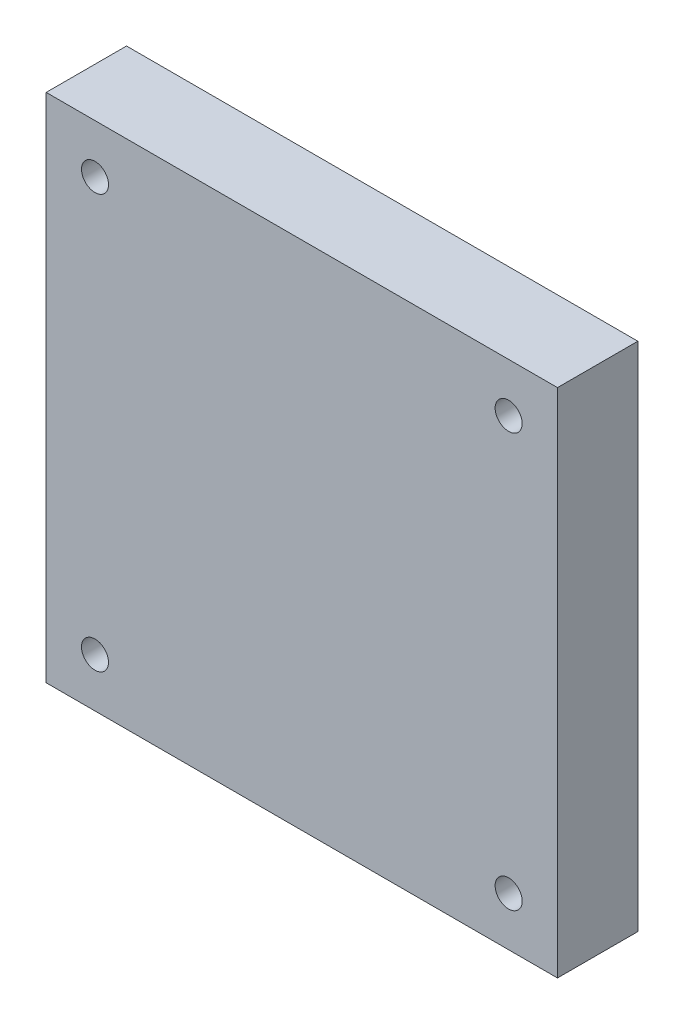
from build123d import *

# Parameters (mm, degrees)
SKETCH1_W           = 50
SKETCH1_H           = 50
BOSS_EXTRUDE1_DEPTH = 1.4
EXTRUDE_D_DEPTH     = 10
SKETCH32_W          = 50
SKETCH32_H          = 5
F_4_FLAT_DEPTH      = 57.789083608
SKETCH9_W           = 70
SKETCH9_H           = 70
SKETCH9_R           = 1.85
BOSS_EXTRUDE5_DEPTH = 10
SKETCH11_W          = 70
SKETCH11_H          = 70
SKETCH11_R          = 1.85
SKETCH11_W_2        = 50
SKETCH11_H_2        = 50
BOSS_EXTRUDE7_DEPTH = 1
SKETCH33_W          = 2.596153847
SKETCH33_H          = 1.25
SKETCH33_W_2        = 1.346153846
SKETCH33_H_2        = 7.692307692
TEXT_4_DEPTH        = 1


with BuildPart() as part:
    # Sketch1 → Boss-Extrude1 (new body)
    with BuildSketch(Plane.XY):
        Rectangle(SKETCH1_W, SKETCH1_H)
    extrude(amount=BOSS_EXTRUDE1_DEPTH)

    # Sketch12 → Extrude d (add)
    with BuildSketch(Plane.XY):
        with BuildLine():
            Line((-15.384615385, -20), (-15.384615385, 20))
            Line((-15.384615385, 20), (-1.706730769, 20))
            add(Edge.make_bspline(
                [(-1.706730769, 20), (-1.332795644, 19.998310706), (-0.606211068, 19.995028279), (0.449226871, 19.974107957), (1.437502743, 19.923648357), (2.354062691, 19.86218189), (3.203529353, 19.780344569), (3.984817479, 19.688830068), (4.698536687, 19.569461366), (5.147259767, 19.470243713), (5.360576923, 19.423076923)],
                knots=[0, 0, 0, 0, 1.263127796, 2.454354013, 3.565393221, 4.605443485, 5.557051711, 6.447822442, 7.26211484, 8, 8, 8, 8], degree=3))
            add(Edge.make_bspline(
                [(5.360576923, 19.423076923), (5.912251843, 19.27833856), (6.996071125, 18.993985904), (8.525996045, 18.354371359), (9.9305337, 17.552091621), (10.76351295, 16.891243678), (11.177884615, 16.5625)],
                knots=[0, 0, 0, 0, 1.04477941, 2.052571232, 3.03123721, 4, 4, 4, 4], degree=3))
            add(Edge.make_bspline(
                [(11.177884615, 16.5625), (11.435165615, 16.33656553), (11.950892228, 15.883673869), (12.659239662, 15.137501768), (13.316361869, 14.345934435), (13.941886088, 13.52259936), (14.495804357, 12.637479906), (15.015025008, 11.716052181), (15.467911147, 10.739812679), (15.884786016, 9.724715962), (16.256193081, 8.666805497), (16.561365357, 7.566764468), (16.841721552, 6.436079941), (17.050241451, 5.26239225), (17.232268536, 4.055656741), (17.347824248, 2.808966533), (17.422800679, 1.526043216), (17.431489341, 0.657162879), (17.435897436, 0.216346154)],
                knots=[0, 0, 0, 0, 0.908997367, 1.822109427, 2.728529095, 3.640759027, 4.565643067, 5.499218265, 6.448003669, 7.421473682, 8.413047621, 9.423472075, 10.452328391, 11.505545429, 12.587978234, 13.692612971, 14.829372988, 16, 16, 16, 16], degree=3))
            add(Edge.make_bspline(
                [(17.435897436, 0.216346154), (17.425152546, -0.521351998), (17.404243244, -1.956895234), (17.197458208, -4.044866145), (16.877475921, -6.007490436), (16.411786994, -7.832983164), (15.838242455, -9.511219494), (15.212555157, -11.055905966), (14.49234461, -12.440426237), (13.702289791, -13.676483907), (12.855766993, -14.771899689), (11.96893387, -15.743113895), (11.039161564, -16.590556291), (10.071173098, -17.336467152), (9.014695501, -17.954101856), (7.880812129, -18.508685792), (6.632736172, -18.954293775), (5.293971254, -19.344076914), (3.848792963, -19.636093055), (2.30502701, -19.850675912), (0.656606295, -19.980436853), (-0.475187738, -19.993352604), (-1.057692308, -20)],
                knots=[0, 0, 0, 0, 1.410753827, 2.745293735, 4.009435601, 5.211453015, 6.344066657, 7.400119332, 8.396481539, 9.324811333, 10.202671465, 11.041621015, 11.837259285, 12.606727868, 13.374311266, 14.17412185, 15.017911533, 15.905707008, 16.839601966, 17.835295848, 18.885883805, 20, 20, 20, 20], degree=3))
            Line((-1.057692308, -20), (-15.384615385, -20))
        make_face()
        with BuildLine():
            Line((-9.743589744, -15.384615385), (-1.498397436, -15.384615385))
            add(Edge.make_bspline(
                [(-1.498397436, -15.384615385), (-0.897178524, -15.375615381), (0.240193705, -15.35858938), (1.844846318, -15.227830177), (3.24533825, -15.0022881), (4.45719944, -14.681402607), (5.508678182, -14.266448389), (6.434510357, -13.775873386), (7.258049637, -13.219181022), (7.72194942, -12.773803849), (7.948717949, -12.556089744)],
                knots=[0, 0, 0, 0, 1.423649224, 2.693227144, 3.808972214, 4.778671344, 5.656058397, 6.479437267, 7.256702014, 8, 8, 8, 8], degree=3))
            add(Edge.make_bspline(
                [(7.948717949, -12.556089744), (8.243811943, -12.218672046), (8.850036503, -11.525500043), (9.604943306, -10.314565428), (10.263258794, -8.95203212), (10.813573136, -7.423395117), (11.264816654, -5.733824846), (11.565778867, -3.868187599), (11.762550487, -1.83916885), (11.783829732, -0.427858936), (11.794871795, 0.304487179)],
                knots=[0, 0, 0, 0, 0.782184731, 1.606876467, 2.483531085, 3.422528604, 4.441347086, 5.534669947, 6.720709839, 8, 8, 8, 8], degree=3))
            add(Edge.make_bspline(
                [(11.794871795, 0.304487179), (11.788030201, 0.814721083), (11.774730419, 1.806595127), (11.69181767, 3.25158927), (11.528135708, 4.603959234), (11.318801793, 5.866044088), (11.032989165, 7.033832073), (10.706157482, 8.118511893), (10.294992017, 9.10590411), (9.82580183, 10.003631417), (9.311094744, 10.81765568), (8.774751475, 11.565461585), (8.214027295, 12.244597356), (7.617040894, 12.845400099), (7.001738383, 13.385636887), (6.356648869, 13.854247255), (5.683577539, 14.251087218), (5.21061462, 14.457089897), (4.975961538, 14.559294872)],
                knots=[0, 0, 0, 0, 1.460126857, 2.838427476, 4.139102445, 5.35666337, 6.496721546, 7.577303074, 8.594995104, 9.55219858, 10.472533725, 11.348579167, 12.184287935, 12.989560785, 13.769667798, 14.524891986, 15.268148459, 16, 16, 16, 16], degree=3))
            add(Edge.make_bspline(
                [(4.975961538, 14.559294872), (4.792612941, 14.626392529), (4.404109286, 14.768568064), (3.770033649, 14.929489388), (3.062398823, 15.077581581), (2.274229901, 15.18152299), (1.409513027, 15.282542702), (0.462873148, 15.343930282), (-0.560725019, 15.37174952), (-1.268682281, 15.380231282), (-1.634615385, 15.384615385)],
                knots=[0, 0, 0, 0, 0.699400087, 1.48198292, 2.341906832, 3.289648813, 4.329964754, 5.462247508, 6.688271602, 8, 8, 8, 8], degree=3))
            Line((-1.634615385, 15.384615385), (-9.743589744, 15.384615385))
            Line((-9.743589744, 15.384615385), (-9.743589744, -15.384615385))
        make_face(mode=Mode.SUBTRACT)
    extrude(amount=EXTRUDE_D_DEPTH)

    # Sketch32 → 4-flat (cut, through all)
    with BuildSketch(Plane.XZ.offset(25)):
        with Locations((0, 12.49)):
            Rectangle(SKETCH32_W, SKETCH32_H)
    extrude(amount=-F_4_FLAT_DEPTH, mode=Mode.SUBTRACT)


with BuildPart() as body_2:
    # Sketch9 → Boss-Extrude5 (new body)
    with BuildSketch(Plane.XY.offset(1.4)):
        Rectangle(SKETCH9_W, SKETCH9_H)
        with Locations((28.313708499, -28.313708499)):
            Circle(SKETCH9_R, mode=Mode.SUBTRACT)
        with Locations((-28.313708499, -28.313708499)):
            Circle(SKETCH9_R, mode=Mode.SUBTRACT)
        with Locations((-28.313708499, 28.313708499)):
            Circle(SKETCH9_R, mode=Mode.SUBTRACT)
        with Locations((28.313708499, 28.313708499)):
            Circle(SKETCH9_R, mode=Mode.SUBTRACT)
    extrude(amount=BOSS_EXTRUDE5_DEPTH)

    # Combine1: cut part
    add(part.part, mode=Mode.SUBTRACT)

    # Sketch11 → Boss-Extrude7 (add)
    with BuildSketch(Plane(origin=(0, 0, 1.4), x_dir=(-1, 0, 0), z_dir=(0, 0, -1))):
        Rectangle(SKETCH11_W, SKETCH11_H)
        with Locations((-28.313708499, -28.313708499)):
            Circle(SKETCH11_R, mode=Mode.SUBTRACT)
        with Locations((28.313708499, -28.313708499)):
            Circle(SKETCH11_R, mode=Mode.SUBTRACT)
        with Locations((28.313708499, 28.313708499)):
            Circle(SKETCH11_R, mode=Mode.SUBTRACT)
        with Locations((-28.313708499, 28.313708499)):
            Circle(SKETCH11_R, mode=Mode.SUBTRACT)
        Rectangle(SKETCH11_W_2, SKETCH11_H_2, mode=Mode.SUBTRACT)
    extrude(amount=BOSS_EXTRUDE7_DEPTH)

    # Sketch33 → text-4 (cut)
    # profile 1 of 6: a face of its own
    with BuildSketch(Plane.XZ.offset(35)):
        Polygon((9.287860577, 2.207692308), (7.884615385, 2.207692308), (7.884615385, 7.111538462), (7.211538462, 7.111538462), (7.211538462, 8.361538462), (7.884615385, 8.361538462), (7.884615385, 9.9), (9.230769231, 9.9), (9.230769231, 8.361538462), (12.403846154, 8.361538462), (12.403846154, 6.998858173), align=None)
        Polygon((9.230769231, 7.111538462), (9.230769231, 4.558954327), (10.890925481, 7.111538462), align=None, mode=Mode.SUBTRACT)
    # profile 2 of 6: a face of its own
    with BuildSketch(Plane.XZ.offset(35)):
        with Locations((4.663461539, 7.159615385)):
            Rectangle(SKETCH33_W, SKETCH33_H)
    # profile 3 of 6: a face of its own
    with BuildSketch(Plane.XZ.offset(35)):
        with BuildLine():
            Line((2.5, 4.419230769), (2.019230769, 4.419230769))
            add(Edge.make_bspline(
                [(2.019230769, 4.419230769), (2.018909483, 4.332089615), (2.018301974, 4.167317541), (2.014714131, 3.933954446), (2.012294671, 3.728605768), (2.007972983, 3.551303093), (2.001890667, 3.402565771), (1.995655651, 3.282401933), (1.990985205, 3.190053414), (1.984400497, 3.138160069), (1.981670673, 3.116646635)],
                knots=[0, 0, 0, 0, 1.604323161, 3.033556972, 4.296844687, 5.385167547, 6.298701784, 7.037230881, 7.60086462, 8, 8, 8, 8], degree=3))
            add(Edge.make_bspline(
                [(1.981670673, 3.116646635), (1.968870201, 3.042836755), (1.943917749, 2.898956322), (1.861317076, 2.698416134), (1.741291639, 2.523722672), (1.614057307, 2.400414792), (1.4961437, 2.316235622), (1.397223982, 2.261255195), (1.289666814, 2.214120164), (1.173124682, 2.177160649), (1.048705977, 2.146969452), (0.915068007, 2.125982028), (0.772943954, 2.114416117), (0.675100668, 2.112512969), (0.625, 2.111538462)],
                knots=[0, 0, 0, 0, 1.43722947, 2.801646624, 4.13175475, 5.486897933, 6.18427957, 6.91287343, 7.658885333, 8.438447905, 9.260561323, 10.118602268, 11.036630026, 12, 12, 12, 12], degree=3))
            add(Edge.make_bspline(
                [(0.625, 2.111538462), (0.548231473, 2.113897415), (0.388833384, 2.118795419), (0.143291222, 2.159647185), (-0.117464635, 2.220719018), (-0.293362492, 2.278419376), (-0.384615385, 2.308353365)],
                knots=[0, 0, 0, 0, 0.891295899, 1.85063944, 2.884947376, 4, 4, 4, 4], degree=3))
            Line((-0.384615385, 2.308353365), (-0.384615385, 3.355528846))
            add(Edge.make_bspline(
                [(-0.384615385, 3.355528846), (-0.335665061, 3.341994907), (-0.242305855, 3.31618266), (-0.107976747, 3.287528773), (0.013057853, 3.269835069), (0.089094519, 3.266803963), (0.124699519, 3.265384615)],
                knots=[0, 0, 0, 0, 1.174725213, 2.24046353, 3.176077791, 4, 4, 4, 4], degree=3))
            add(Edge.make_bspline(
                [(0.124699519, 3.265384615), (0.163947673, 3.265953584), (0.23759192, 3.267021182), (0.338529747, 3.289855768), (0.426558231, 3.318059591), (0.471500659, 3.353680425), (0.492788462, 3.370552885)],
                knots=[0, 0, 0, 0, 1.200739268, 2.253036902, 3.172518975, 4, 4, 4, 4], degree=3))
            add(Edge.make_bspline(
                [(0.492788462, 3.370552885), (0.506447776, 3.386933738), (0.53628391, 3.42271455), (0.559054252, 3.498508954), (0.576037267, 3.591558731), (0.576609836, 3.661380955), (0.576923077, 3.699579327)],
                knots=[0, 0, 0, 0, 0.730107156, 1.594778094, 2.684150175, 4, 4, 4, 4], degree=3))
            Line((0.576923077, 3.699579327), (0.581430288, 4.419230769))
            Line((0.581430288, 4.419230769), (-0.288461538, 4.419230769))
            Line((-0.288461538, 4.419230769), (-0.288461538, 5.573076923))
            Line((-0.288461538, 5.573076923), (0.673076923, 5.573076923))
            Line((0.673076923, 5.573076923), (0.673076923, 9.9))
            Line((0.673076923, 9.9), (2.019230769, 9.9))
            Line((2.019230769, 9.9), (2.019230769, 5.573076923))
            Line((2.019230769, 5.573076923), (2.5, 5.573076923))
            Line((2.5, 5.573076923), (2.5, 4.419230769))
        make_face()
    # profile 4 of 6: a face of its own
    with BuildSketch(Plane.XZ.offset(35)):
        with Locations((-1.634615385, 6.053846154)):
            Rectangle(SKETCH33_W_2, SKETCH33_H_2)
    # profile 5 of 6: a face of its own
    with BuildSketch(Plane.XZ.offset(35)):
        with BuildLine():
            Line((-7.692307692, 4.419230769), (-9.038461538, 4.419230769))
            Line((-9.038461538, 4.419230769), (-9.038461538, 9.9))
            Line((-9.038461538, 9.9), (-7.692307692, 9.9))
            Line((-7.692307692, 9.9), (-7.692307692, 9.302043269))
            add(Edge.make_bspline(
                [(-7.692307692, 9.302043269), (-7.625488732, 9.360074686), (-7.495584917, 9.472894498), (-7.293158093, 9.621829792), (-7.087372706, 9.739854752), (-6.882311822, 9.837817852), (-6.670900063, 9.907700981), (-6.453408879, 9.959638178), (-6.226811606, 9.989902765), (-6.072804406, 9.994048448), (-5.994591346, 9.996153846)],
                knots=[0, 0, 0, 0, 1.129087683, 2.195077524, 3.200104641, 4.152071996, 5.089690739, 6.035159067, 7.002149119, 8, 8, 8, 8], degree=3))
            add(Edge.make_bspline(
                [(-5.994591346, 9.996153846), (-5.90679034, 9.994179284), (-5.733290575, 9.990277436), (-5.478706621, 9.949180385), (-5.232850586, 9.886323296), (-4.996064619, 9.797186258), (-4.76800184, 9.682247486), (-4.549838284, 9.541835957), (-4.340588128, 9.37624396), (-4.1434782, 9.187149991), (-3.961081537, 8.980239978), (-3.800763279, 8.758813642), (-3.666036304, 8.524042041), (-3.556566087, 8.277105213), (-3.470097383, 8.018105201), (-3.408512551, 7.746450941), (-3.372164154, 7.462091039), (-3.367666351, 7.268394467), (-3.365384615, 7.170132212)],
                knots=[0, 0, 0, 0, 0.980635182, 1.937790695, 2.874612845, 3.813473129, 4.759763495, 5.72404569, 6.708444218, 7.737858197, 8.773145527, 9.787642451, 10.788159158, 11.793035368, 12.802034882, 13.835443946, 14.901920881, 16, 16, 16, 16], degree=3))
            add(Edge.make_bspline(
                [(-3.365384615, 7.170132212), (-3.36777689, 7.068380381), (-3.372469603, 6.868782827), (-3.406874129, 6.575904846), (-3.467198205, 6.297456922), (-3.550281027, 6.032998797), (-3.65468778, 5.781748892), (-3.787184468, 5.546716112), (-3.940902639, 5.324297486), (-4.116959442, 5.118725468), (-4.310137727, 4.933729001), (-4.513908031, 4.769500578), (-4.728599626, 4.630793334), (-4.9547511, 4.518894103), (-5.189981771, 4.431570533), (-5.435444055, 4.3678198), (-5.691392879, 4.329505755), (-5.865754879, 4.325237664), (-5.954026442, 4.323076923)],
                knots=[0, 0, 0, 0, 1.136340375, 2.229058262, 3.287747549, 4.313796199, 5.321476843, 6.32056726, 7.321347234, 8.336944959, 9.337787455, 10.30479778, 11.255888616, 12.186428358, 13.117354666, 14.053442213, 15.014546185, 16, 16, 16, 16], degree=3))
            add(Edge.make_bspline(
                [(-5.954026442, 4.323076923), (-6.035803562, 4.32473283), (-6.197611006, 4.328009274), (-6.435160916, 4.365108239), (-6.666205686, 4.417962402), (-6.888610421, 4.49674232), (-7.103450804, 4.598102368), (-7.309193238, 4.722107803), (-7.508593458, 4.866597305), (-7.630313005, 4.979310973), (-7.692307692, 5.03671875)],
                knots=[0, 0, 0, 0, 1.016860689, 2.012000776, 2.985574089, 3.963288254, 4.94189597, 5.937036056, 6.949282938, 8, 8, 8, 8], degree=3))
            Line((-7.692307692, 5.03671875), (-7.692307692, 4.419230769))
        make_face()
        with BuildLine():
            add(Edge.make_bspline(
                [(-6.236478365, 5.573076923), (-6.182838533, 5.574723508), (-6.077707963, 5.577950708), (-5.92309175, 5.597343943), (-5.775353156, 5.631570761), (-5.635414297, 5.681943511), (-5.501907063, 5.743856985), (-5.374803235, 5.818877303), (-5.255927423, 5.910316657), (-5.14409319, 6.013146698), (-5.041449097, 6.126315588), (-4.955140989, 6.250787544), (-4.878509852, 6.380579261), (-4.816696585, 6.519086614), (-4.770936604, 6.666143169), (-4.735229566, 6.820115776), (-4.716611391, 6.982379423), (-4.713246357, 7.09296946), (-4.711538462, 7.149098558)],
                knots=[0, 0, 0, 0, 1.048146026, 2.054297773, 3.039291333, 4.004895774, 4.954855183, 5.911393651, 6.882091317, 7.879305688, 8.877191939, 9.859995919, 10.833402353, 11.818978979, 12.815424932, 13.838562528, 14.902979527, 16, 16, 16, 16], degree=3))
            add(Edge.make_bspline(
                [(-4.711538462, 7.149098558), (-4.713220993, 7.205736551), (-4.716536401, 7.317341061), (-4.735521569, 7.480976691), (-4.769978421, 7.637186591), (-4.82061724, 7.784452874), (-4.881110728, 7.925524583), (-4.959623898, 8.056875295), (-5.049117083, 8.181927293), (-5.152979119, 8.297184483), (-5.266313275, 8.400936734), (-5.385851354, 8.494631945), (-5.513221868, 8.572046552), (-5.647079593, 8.636063855), (-5.786523157, 8.685661736), (-5.933128413, 8.720328193), (-6.085614434, 8.741574812), (-6.189835716, 8.744616962), (-6.242487981, 8.746153846)],
                knots=[0, 0, 0, 0, 1.099575806, 2.166701374, 3.192649988, 4.197894673, 5.185929295, 6.166282287, 7.161891816, 8.166995477, 9.171440763, 10.141716722, 11.110384286, 12.058293159, 13.017598555, 13.97724868, 14.978112372, 16, 16, 16, 16], degree=3))
            add(Edge.make_bspline(
                [(-6.242487981, 8.746153846), (-6.297127754, 8.744499444), (-6.404251413, 8.741255917), (-6.561378306, 8.722019822), (-6.711144596, 8.687740424), (-6.852806545, 8.636814135), (-6.989205782, 8.576102568), (-7.117201019, 8.498591641), (-7.237993959, 8.407482043), (-7.351556135, 8.30519202), (-7.453548882, 8.190334187), (-7.544620459, 8.067470192), (-7.619839116, 7.933899302), (-7.681443436, 7.792332206), (-7.729749222, 7.642384173), (-7.764585599, 7.483997513), (-7.783493492, 7.316823702), (-7.786784585, 7.202728005), (-7.788461538, 7.144591346)],
                knots=[0, 0, 0, 0, 1.050055163, 2.05867895, 3.036770115, 3.995495956, 4.947241397, 5.901173699, 6.863515112, 7.851357518, 8.832757047, 9.810564118, 10.784575339, 11.771479801, 12.772731182, 13.807147486, 14.882647436, 16, 16, 16, 16], degree=3))
            add(Edge.make_bspline(
                [(-7.788461538, 7.144591346), (-7.786806972, 7.087453952), (-7.783575124, 6.975848024), (-7.764486645, 6.812173968), (-7.729482495, 6.656864018), (-7.681750138, 6.509217779), (-7.619839329, 6.370208209), (-7.54415232, 6.239466724), (-7.453582256, 6.118296928), (-7.351439986, 6.005068198), (-7.238407674, 5.904118562), (-7.116494749, 5.8156314), (-6.9875015, 5.740975346), (-6.851612917, 5.67811122), (-6.707428042, 5.632489084), (-6.557441203, 5.597072646), (-6.399224147, 5.577961643), (-6.291612235, 5.574731734), (-6.236478365, 5.573076923)],
                knots=[0, 0, 0, 0, 1.106253802, 2.160835036, 3.183977744, 4.183421548, 5.159890935, 6.124302589, 7.101541683, 8.083003376, 9.071668641, 10.029626693, 10.994038348, 11.952829982, 12.921617172, 13.916395167, 14.932486243, 16, 16, 16, 16], degree=3))
        make_face(mode=Mode.SUBTRACT)
    # profile 6 of 6: a face of its own
    with BuildSketch(Plane.XZ.offset(35)):
        Polygon((-10.480769231, 2.207692308), (-11.826923077, 2.207692308), (-11.826923077, 4.419230769), (-12.692307692, 4.419230769), (-12.692307692, 5.573076923), (-11.826923077, 5.573076923), (-11.826923077, 9.9), (-10.480769231, 9.9), (-10.480769231, 5.573076923), (-9.807692308, 5.573076923), (-9.807692308, 4.419230769), (-10.480769231, 4.419230769), align=None)
    extrude(amount=-TEXT_4_DEPTH, mode=Mode.SUBTRACT)


solid = body_2.part
